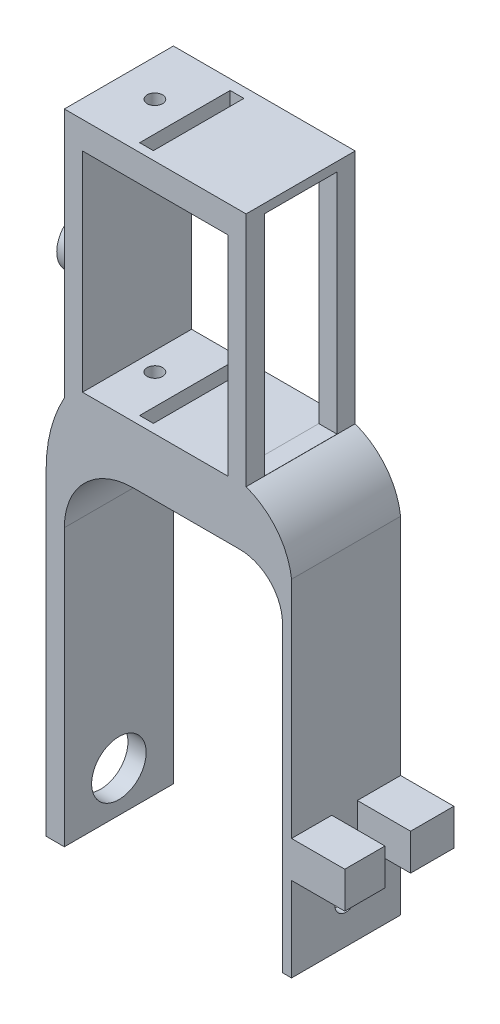
from build123d import *

# Parameters (mm, degrees)
BOSS_EXTRUDE1_DEPTH = 30
SKETCH8_W           = 20
SKETCH8_H           = 62.459356161
CUT_EXTRUDE10_DEPTH = 10
SKETCH9_W           = 40
SKETCH9_H           = 57.485293174
CUT_EXTRUDE11_DEPTH = 171.042625644
SKETCH10_W          = 3.787442447
SKETCH10_H          = 24.89779836
CUT_EXTRUDE12_DEPTH = 192.169588314
SKETCH11_R          = 7.5
BOSS_EXTRUDE3_DEPTH = 10
SKETCH13_W          = 7.039311569
SKETCH13_H          = 10
CUT_EXTRUDE13_DEPTH = 14.644416288
CUT_EXTRUDE14_DEPTH = 10
CUT_EXTRUDE15_START = -10
SKETCH15_R          = 7.5
SKETCH15_R_2        = 3.05
CUT_EXTRUDE15_DEPTH = 10
SKETCH16_R          = 2.125
CUT_EXTRUDE16_DEPTH = 192.169588314


with BuildPart() as part:
    # Sketch1 → Boss-Extrude1 (new body)
    with BuildSketch(Plane.XY):
        with BuildLine():
            Line((-13.258302459, -23.24297657), (-8.258302459, -23.24297657))
            Line((-8.258302459, -23.24297657), (-8.258302459, 52.783973791))
            ThreePointArc((-8.258302459, 52.783973791), (-2.701224879, 66.199945851), (10.714747181, 71.75702343))
            Line((10.714747181, 71.75702343), (40.003717522, 71.75702343))
            ThreePointArc((40.003717522, 71.75702343), (48.303722791, 68.31904868), (51.741697541, 60.019043411))
            Line((51.741697541, 60.019043411), (51.741697541, -23.24297657))
            Line((51.741697541, -23.24297657), (54.241697541, -23.24297657))
            Line((54.241697541, -23.24297657), (54.241697541, 0))
            Line((54.241697541, 0), (68.88611383, 0))
            Line((68.88611383, 0), (68.88611383, 10))
            Line((68.88611383, 10), (54.241697541, 10))
            Line((54.241697541, 10), (54.241697541, 71.75702343))
            ThreePointArc((54.241697541, 71.75702343), (50.23063048, 81.422678209), (41.741697541, 87.542446084))
            Line((41.741697541, 87.542446084), (41.741697541, 152.542446084))
            Line((41.741697541, 152.542446084), (-8.258302459, 152.542446084))
            Line((-8.258302459, 152.542446084), (-8.258302459, 83.691556541))
            ThreePointArc((-8.258302459, 83.691556541), (-11.988106196, 74.334235436), (-13.258302459, 64.341363194))
            Line((-13.258302459, 64.341363194), (-13.258302459, -23.24297657))
        make_face()
    extrude(amount=-BOSS_EXTRUDE1_DEPTH)

    # Sketch8 → Cut-Extrude10 (cut)
    with BuildSketch(Plane(origin=(41.741697541, 0, 0), x_dir=(0, 0, -1), z_dir=(1, 0, 0))):
        with Locations((15, 118.812768003)):
            Rectangle(SKETCH8_W, SKETCH8_H)
    extrude(amount=-CUT_EXTRUDE10_DEPTH, mode=Mode.SUBTRACT)

    # Sketch9 → Cut-Extrude11 (cut, through all)
    with BuildSketch(Plane.XY):
        with Locations((16.741697541, 116.299799497)):
            Rectangle(SKETCH9_W, SKETCH9_H)
    extrude(amount=-CUT_EXTRUDE11_DEPTH, mode=Mode.SUBTRACT)

    # Sketch10 → Cut-Extrude12 (cut, through all)
    with BuildSketch(Plane(origin=(0, 152.542446084, 0), x_dir=(1, 0, 0), z_dir=(0, 1, 0))):
        with Locations((12.030722262, 14.765280162)):
            Rectangle(SKETCH10_W, SKETCH10_H)
    extrude(amount=-CUT_EXTRUDE12_DEPTH, mode=Mode.SUBTRACT)

    # Sketch11 → Boss-Extrude3 (add)
    with BuildSketch(Plane.ZY.offset(8.258302459)):
        with Locations(Location((-15.40420704, 109.542446084, 0), (0, 0, 270))):
            Circle(SKETCH11_R)
    extrude(amount=BOSS_EXTRUDE3_DEPTH)

    # Sketch13 → Cut-Extrude13 (cut)
    with BuildSketch(Plane(origin=(68.88611383, 0, 0), x_dir=(0, 0, -1), z_dir=(1, 0, 0))):
        with Locations((14.579402423, 5)):
            Rectangle(SKETCH13_W, SKETCH13_H)
    extrude(amount=-CUT_EXTRUDE13_DEPTH, mode=Mode.SUBTRACT)

    # Sketch14 → Cut-Extrude14 (cut)
    with BuildSketch(Plane(origin=(54.241697541, 0, 0), x_dir=(0, 0, -1), z_dir=(1, 0, 0))):
        with BuildLine():
            ThreePointArc((15, -8.95), (11.95, -12), (15, -15.05))
            Line((15, -15.05), (15, -8.95))
        make_face()
        with BuildLine():
            Line((15, -8.95), (15, -15.05))
            ThreePointArc((15, -15.05), (17.156675683, -14.156675683), (18.05, -12))
            ThreePointArc((18.05, -12), (17.156675683, -9.843324317), (15, -8.95))
        make_face()
    extrude(amount=-CUT_EXTRUDE14_DEPTH, mode=Mode.SUBTRACT)

    # Sketch15 → Cut-Extrude15 (cut)
    # profile 1 of 2: a face of its own
    with BuildSketch(Plane.ZY.offset(13.258302459).offset(CUT_EXTRUDE15_START)):
        with Locations((-15, -12)):
            Circle(SKETCH15_R)
        with Locations(Location((-15, -12, 0), (0, 0, 180))):
            Circle(SKETCH15_R_2, mode=Mode.SUBTRACT)
    # profile 2 of 2: a face of its own
    with BuildSketch(Plane.ZY.offset(13.258302459).offset(CUT_EXTRUDE15_START)):
        with Locations(Location((-15, -12, 0), (0, 0, 180))):
            Circle(SKETCH15_R_2)
    extrude(amount=CUT_EXTRUDE15_DEPTH, mode=Mode.SUBTRACT)

    # Sketch16 → Cut-Extrude16 (cut, through all)
    with BuildSketch(Plane(origin=(0, 152.542446084, 0), x_dir=(1, 0, 0), z_dir=(0, 1, 0))):
        with Locations(Location((1.873560728, 14.765280162, 0), (0, 0, 270))):
            Circle(SKETCH16_R)
    extrude(amount=-CUT_EXTRUDE16_DEPTH, mode=Mode.SUBTRACT)


solid = part.part
